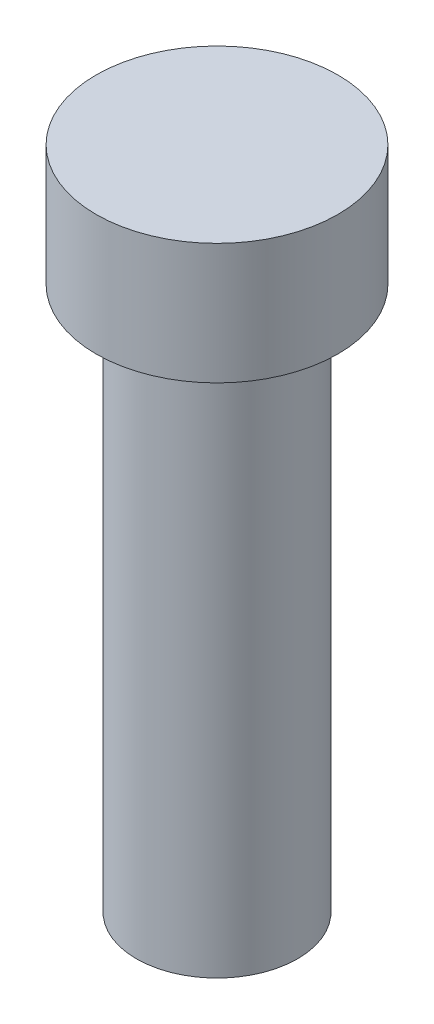
from build123d import *

# Parameters (mm, degrees)
SKETCH1_R           = 3
BOSS_EXTRUDE1_DEPTH = 3
SKETCH2_R           = 2
BOSS_EXTRUDE2_DEPTH = 13.5


with BuildPart() as part:
    # Sketch1 → Boss-Extrude1 (new body)
    with BuildSketch(Plane(origin=(0, 0, 0), x_dir=(1, 0, 0), z_dir=(0, 1, 0))):
        with Locations(Location((0, 0, 0), (0, 0, 270))):
            Circle(SKETCH1_R)
    extrude(amount=BOSS_EXTRUDE1_DEPTH)

    # Sketch2 → Boss-Extrude2 (add)
    with BuildSketch(Plane.XZ):
        with Locations(Location((0, 0, 0), (0, 0, 270))):
            Circle(SKETCH2_R)
    extrude(amount=BOSS_EXTRUDE2_DEPTH)


solid = part.part
